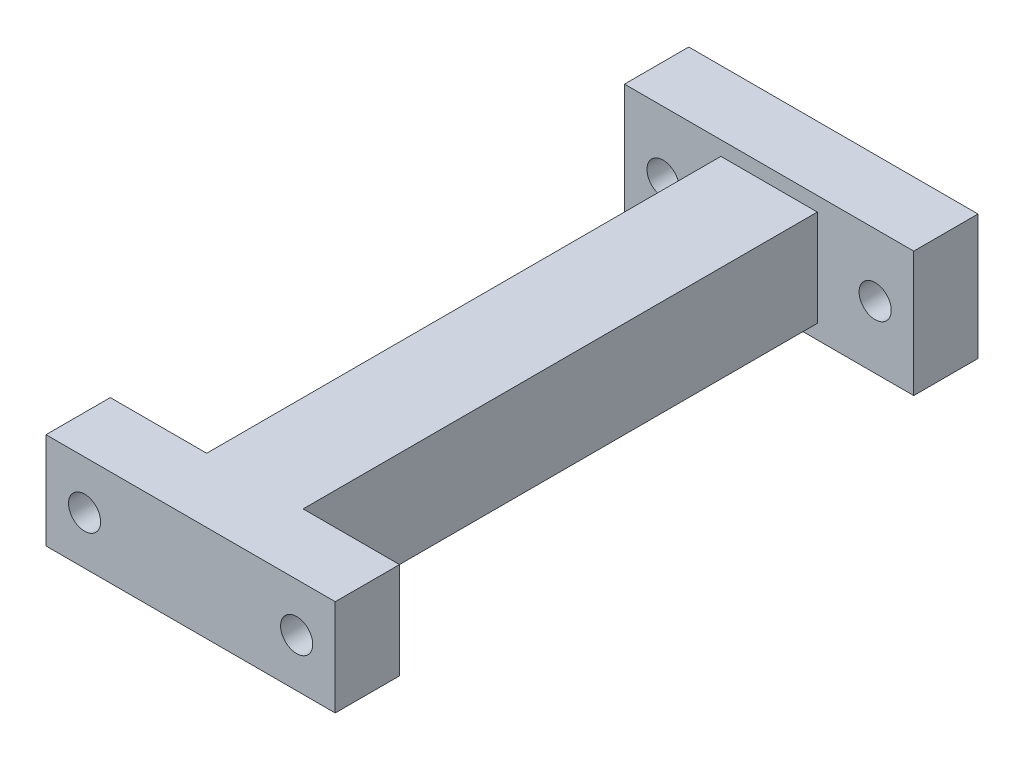
from build123d import *

# Parameters (mm, degrees)
SKETCH_1_W          = 15
SKETCH_1_H          = 15
EXTRUDE_1_DEPTH     = 100
SKETCH_2_W          = 45
SKETCH_2_H          = 15
EXTRUDE_2_DEPTH     = 10
SKETCH_3_R          = 2.5
CUT_EXTRUDE_1_DEPTH = 20
SKETCH_5_W          = 45
SKETCH_5_H          = 19.472765692
EXTRUDE_3_DEPTH     = 10
SKETCH_6_R          = 2.5
CUT_EXTRUDE_2_DEPTH = 103.961386699


with BuildPart() as part:
    # 草图1 → 凸台-拉伸1 (new body)
    with BuildSketch(Plane.XY):
        Rectangle(SKETCH_1_W, SKETCH_1_H)
    extrude(amount=EXTRUDE_1_DEPTH)

    # 草图2 → 凸台-拉伸2 (add)
    with BuildSketch(Plane.XY.offset(100)):
        Rectangle(SKETCH_2_W, SKETCH_2_H)
    extrude(amount=-EXTRUDE_2_DEPTH)

    # 草图3 → 切除-拉伸1 (cut)
    with BuildSketch(Plane.XY.offset(100)):
        with Locations((-16.5, 0)):
            Circle(SKETCH_3_R)
        with Locations((16.5, 0)):
            Circle(SKETCH_3_R)
    extrude(amount=-CUT_EXTRUDE_1_DEPTH, mode=Mode.SUBTRACT)

    # 草图5 → 凸台-拉伸3 (add)
    with BuildSketch(Plane(origin=(0, 0, 0), x_dir=(-1, 0, 0), z_dir=(0, 0, -1))):
        Rectangle(SKETCH_5_W, SKETCH_5_H)
    extrude(amount=-EXTRUDE_3_DEPTH)

    # 草图6 → 切除-拉伸2 (cut, through all)
    with BuildSketch(Plane(origin=(0, 0, 0), x_dir=(-1, 0, 0), z_dir=(0, 0, -1))):
        with Locations(Location((-16.5, 0, 0), (0, 0, 180))):
            Circle(SKETCH_6_R)
        with Locations(Location((16.5, 0, 0), (0, 0, 180))):
            Circle(SKETCH_6_R)
    extrude(amount=-CUT_EXTRUDE_2_DEPTH, mode=Mode.SUBTRACT)


solid = part.part
